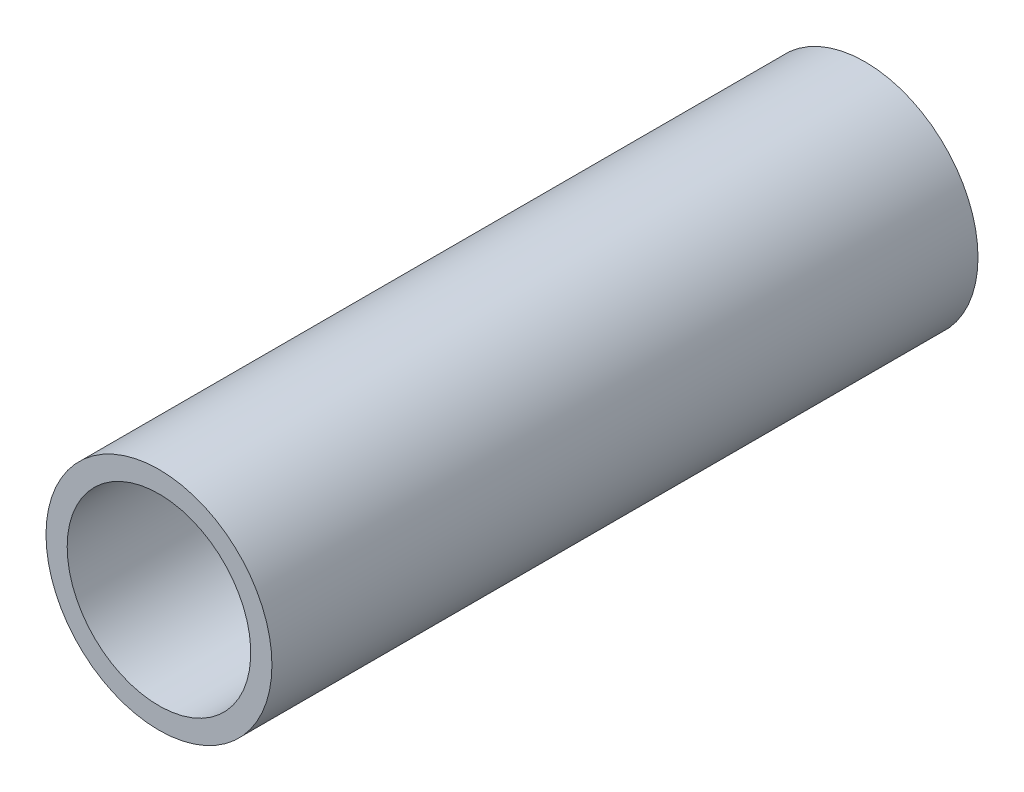
from build123d import *

# Parameters (mm, degrees)
CROQUIS1_R     = 16
EXTRUIR1_DEPTH = 50
VACIADO1_T     = -3


with BuildPart() as part:
    # Croquis1 → Extruir1 (new, symmetric)
    with BuildSketch(Plane.XY):
        with Locations(Location((0, 0, 0), (0, 0, 180))):
            Circle(CROQUIS1_R)
    extrude(amount=EXTRUIR1_DEPTH, both=True)

    # Vaciado1
    vaciado1_openings = [part.faces().sort_by_distance(p)[0] for p in [
        (0, 0, 50),
        (0, 0, -50),
    ]]
    offset(amount=VACIADO1_T, openings=vaciado1_openings, kind=Kind.INTERSECTION)


solid = part.part
